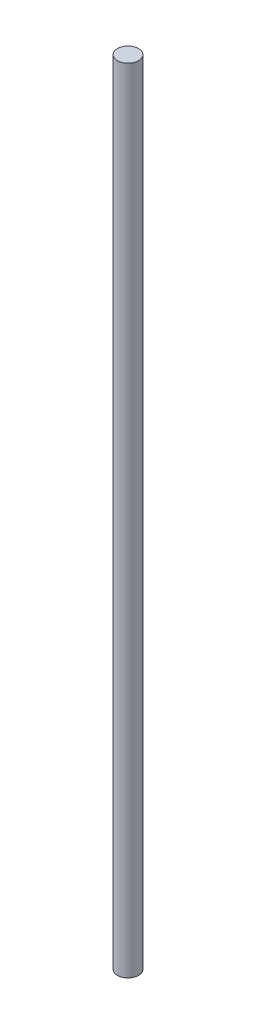
from build123d import *

# Parameters (mm, degrees)
SKETCH_1_R      = 6
EXTRUDE_1_DEPTH = 450


with BuildPart() as part:
    # Эскиз1 → Бобышка-Вытянуть1 (new body)
    with BuildSketch(Plane(origin=(0, 0, 0), x_dir=(1, 0, 0), z_dir=(0, 1, 0))):
        with Locations(Location((0, 0, 0), (0, 0, 270))):
            Circle(SKETCH_1_R)
    extrude(amount=EXTRUDE_1_DEPTH)


solid = part.part
